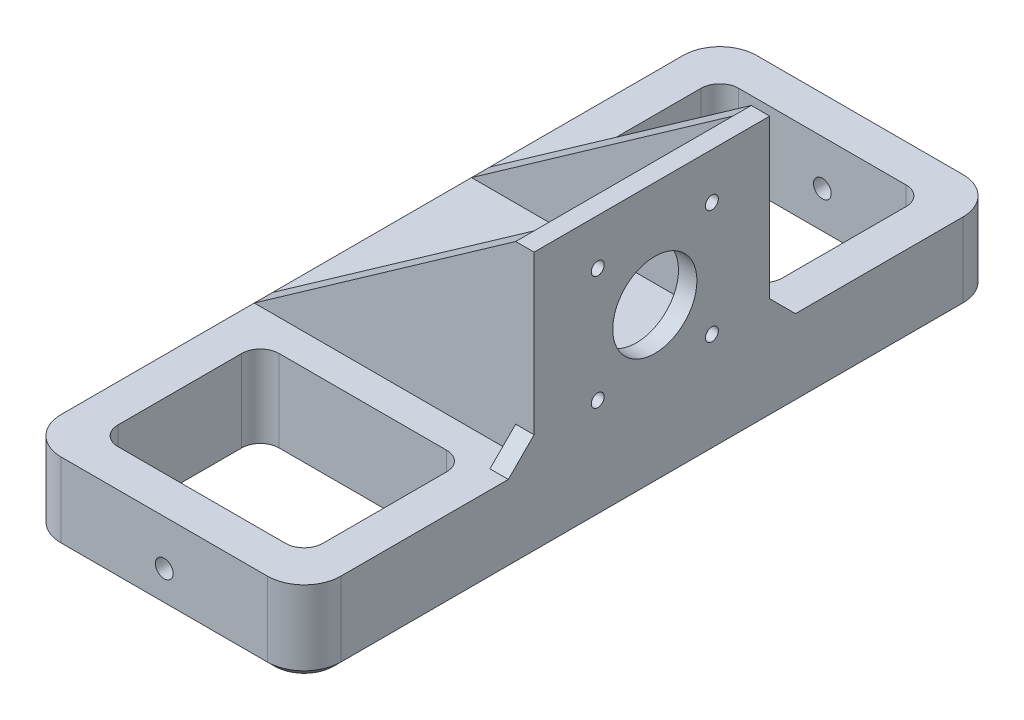
from build123d import *

# Parameters (mm, degrees)
BOSS_EXTRUDE1_DEPTH      = 64
BOSS_EXTRUDE1_DEPTH_BACK = 12
SKETCH1_W                = 188.9125
SKETCH1_H                = 22.225
SKETCH3_W                = 60
SKETCH3_H                = 50
BOSS_EXTRUDE2_DEPTH      = 5
SKETCH4_R                = 11.43
SKETCH4_R_2              = 1.7499965
SKETCH4_R_3              = 1.75
CUT_EXTRUDE1_DEPTH       = 5
FILLET2_R                = 10
FILLET3_R                = 10
FILLET6_R                = 10
FILLET8_R                = 10
SKETCH18_W               = 5
SKETCH18_H               = 2
BOSS_EXTRUDE4_DEPTH      = 49.97124
SKETCH19_W               = 5
SKETCH19_H               = 2
BOSS_EXTRUDE5_DEPTH      = 49.971244
SKETCH26_R               = 2.413
CUT_EXTRUDE3_DEPTH       = 31.496
CHAMFER1_SIZE            = 7
CHAMFER2_SIZE            = 2
BOSS_EXTRUDE6_DEPTH      = 5
BOSS_EXTRUDE7_DEPTH      = 5
CUT_EXTRUDE2_DEPTH       = 126.162645094
CUT_EXTRUDE4_START       = 16.51
SKETCH27_R               = 2.413
CUT_EXTRUDE4_DEPTH       = 16.51


with BuildPart() as part:
    # Sketch1 → Boss-Extrude1 (new, two sides: drawn at the far end of the back side and taken through both)
    with BuildSketch(Plane(origin=(0, 0, 0), x_dir=(0, 0, -1), z_dir=(1, 0, 0)).offset(-BOSS_EXTRUDE1_DEPTH_BACK)):
        with Locations((-0.79375, -6.6675)):
            Rectangle(SKETCH1_W, SKETCH1_H)
    extrude(amount=BOSS_EXTRUDE1_DEPTH + BOSS_EXTRUDE1_DEPTH_BACK)

    # Sketch3 → Boss-Extrude2 (add)
    with BuildSketch(Plane(origin=(64, 8.866131276, 9.663552159), x_dir=(0, 0, -1), z_dir=(1, 0, 0))):
        with Locations((8.869802159, 20.550112642)):
            Rectangle(SKETCH3_W, SKETCH3_H)
    extrude(amount=-BOSS_EXTRUDE2_DEPTH)

    # Sketch4 → Cut-Extrude1 (cut)
    with BuildSketch(Plane(origin=(64, 0, 0), x_dir=(0, 0, -1), z_dir=(1, 0, 0))):
        with Locations((0, 25.6032)):
            Circle(SKETCH4_R)
        with Locations((-15.5, 41.945)):
            Circle(SKETCH4_R_2)
        with Locations((15.5, 41.945)):
            Circle(SKETCH4_R_2)
        with Locations((-15.5, 10.945)):
            Circle(SKETCH4_R_3)
        with Locations((15.5, 10.945)):
            Circle(SKETCH4_R_3)
    extrude(amount=-CUT_EXTRUDE1_DEPTH, mode=Mode.SUBTRACT)

    # Fillet2
    fillet2_edges = [part.edges().sort_by_distance(p)[0] for p in [
        (-12, -6.6675, 95.25),
    ]]
    fillet(fillet2_edges, radius=FILLET2_R)

    # Fillet3
    fillet3_edges = [part.edges().sort_by_distance(p)[0] for p in [
        (64, -6.6675, 95.25),
    ]]
    fillet(fillet3_edges, radius=FILLET3_R)

    # Fillet6
    fillet6_edges = [part.edges().sort_by_distance(p)[0] for p in [
        (-12, -6.6675, -93.6625),
    ]]
    fillet(fillet6_edges, radius=FILLET6_R)

    # Fillet8
    fillet8_edges = [part.edges().sort_by_distance(p)[0] for p in [
        (64, -6.6675, -93.6625),
    ]]
    fillet(fillet8_edges, radius=FILLET8_R)

    # Sketch18 → Boss-Extrude4 (add)
    with BuildSketch(Plane(origin=(0, 4.445, 0), x_dir=(1, 0, 0), z_dir=(0, 1, 0))):
        with Locations((61.5, -31.79375)):
            Rectangle(SKETCH18_W, SKETCH18_H)
    extrude(amount=BOSS_EXTRUDE4_DEPTH)

    # Sketch19 → Boss-Extrude5 (add)
    with BuildSketch(Plane(origin=(0, 4.445, 0), x_dir=(1, 0, 0), z_dir=(0, 1, 0))):
        with Locations((61.5, 30.20625)):
            Rectangle(SKETCH19_W, SKETCH19_H)
    extrude(amount=BOSS_EXTRUDE5_DEPTH)

    # Sketch26 → Cut-Extrude3 (cut)
    with BuildSketch(Plane.XY.offset(95.25)):
        with Locations((26, -7.78)):
            Circle(SKETCH26_R)
    extrude(amount=-CUT_EXTRUDE3_DEPTH, mode=Mode.SUBTRACT)

    # Chamfer1
    chamfer1_edges = [part.edges().sort_by_distance(p)[0] for p in [
        (61.5, 4.445, -31.20625),
        (61.5, 4.445, 32.79375),
    ]]
    chamfer(chamfer1_edges, length=CHAMFER1_SIZE)

    # Chamfer2
    chamfer2_edges = [part.edges().sort_by_distance(p)[0] for p in [
        (-12, -17.78, 0.79375),
        (26, -17.78, 95.25),
        (-9.071067812, -17.78, 92.321067812),
        (64, -17.78, 0.79375),
        (61.071067812, -17.78, 92.321067812),
        (26, -17.78, -93.6625),
        (-9.071067812, -17.78, -90.733567812),
        (61.071067812, -17.78, -90.733567812),
    ]]
    chamfer(chamfer2_edges, length=CHAMFER2_SIZE)

    # Sketch20 → Boss-Extrude6 (add)
    with BuildSketch(Plane(origin=(0, 0, -31.20625), x_dir=(-1, 0, 0), z_dir=(0, 0, -1))):
        Polygon((-59, 54.416243918), (12, 4.445), (-59, 4.445), align=None)
    extrude(amount=-BOSS_EXTRUDE6_DEPTH)

    # Sketch21 → Boss-Extrude7 (add)
    with BuildSketch(Plane.XY.offset(32.79375)):
        Polygon((59, 54.416243918), (-12, 4.445), (59, 4.445), align=None)
    extrude(amount=-BOSS_EXTRUDE7_DEPTH)

    # Sketch23 → Cut-Extrude2 (cut, through all)
    with BuildSketch(Plane(origin=(0, 4.445, 0), x_dir=(1, 0, 0), z_dir=(0, 1, 0))):
        with BuildLine():
            Line((48.76, -41.29394195), (3.24, -41.29394195))
            ThreePointArc((3.24, -41.29394195), (-0.352102448, -42.781839501), (-1.84, -46.37394195))
            Line((-1.84, -46.37394195), (-1.84, -80.01))
            ThreePointArc((-1.84, -80.01), (-0.352102448, -83.602102448), (3.24, -85.09))
            Line((3.24, -85.09), (48.76, -85.09))
            ThreePointArc((48.76, -85.09), (52.352102448, -83.602102448), (53.84, -80.01))
            Line((53.84, -80.01), (53.84, -46.37394195))
            ThreePointArc((53.84, -46.37394195), (52.352102448, -42.781839501), (48.76, -41.29394195))
        make_face()
        with BuildLine():
            Line((48.76, 83.5025), (3.24, 83.5025))
            ThreePointArc((3.24, 83.5025), (-0.352102448, 82.014602448), (-1.84, 78.4225))
            Line((-1.84, 78.4225), (-1.84, 44.78644195))
            ThreePointArc((-1.84, 44.78644195), (-0.352102448, 41.194339501), (3.24, 39.70644195))
            Line((3.24, 39.70644195), (48.76, 39.70644195))
            ThreePointArc((48.76, 39.70644195), (52.352102448, 41.194339501), (53.84, 44.78644195))
            Line((53.84, 44.78644195), (53.84, 78.4225))
            ThreePointArc((53.84, 78.4225), (52.352102448, 82.014602448), (48.76, 83.5025))
        make_face()
    extrude(amount=-CUT_EXTRUDE2_DEPTH, mode=Mode.SUBTRACT)

    # Sketch27 → Cut-Extrude4 (cut)
    with BuildSketch(Plane.XY.offset(-93.6625).offset(CUT_EXTRUDE4_START)):
        with Locations((26, -7.78)):
            Circle(SKETCH27_R)
    extrude(amount=-CUT_EXTRUDE4_DEPTH, mode=Mode.SUBTRACT)


solid = part.part
